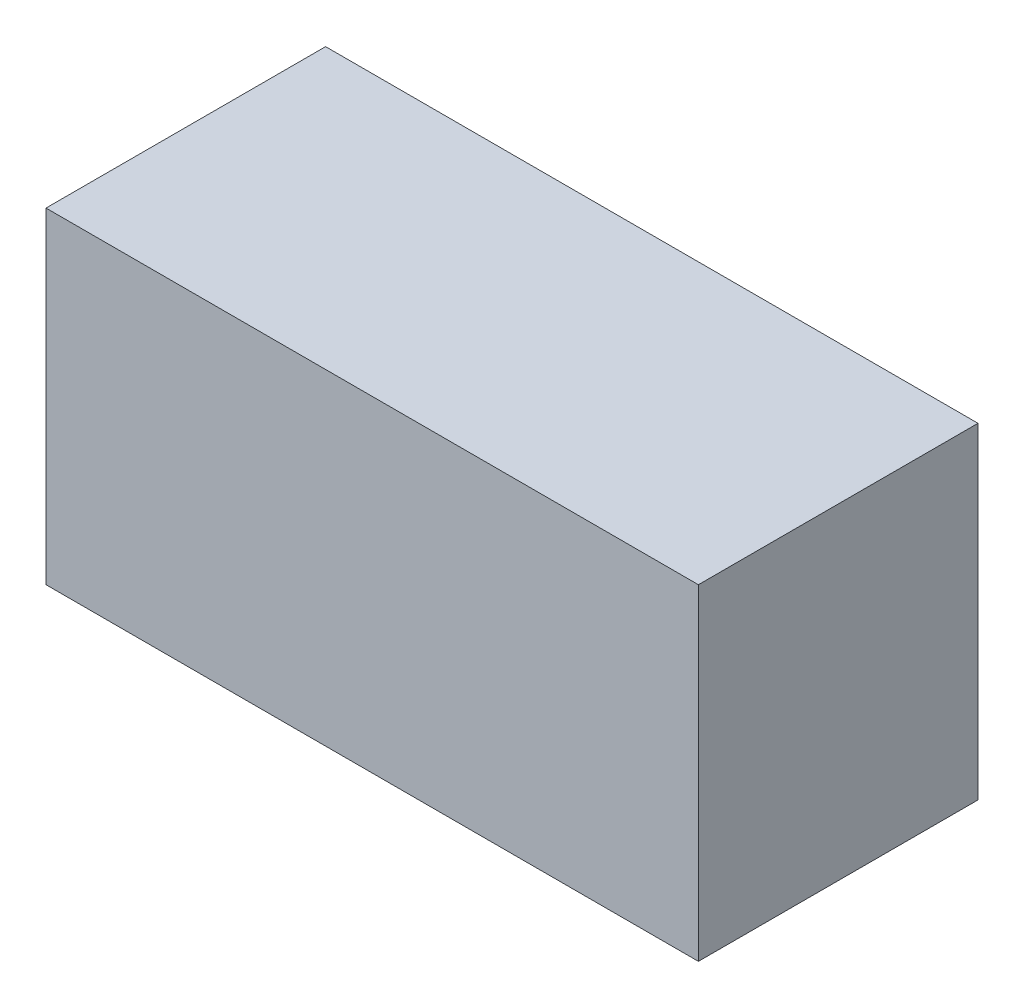
from build123d import *

# Parameters (mm, degrees)
IZIM1_W                     = 140
IZIM1_H                     = 70
Y_KSEKLIK_EKSTR_ZYON1_DEPTH = 60
IZIM10_W                    = 130
IZIM10_H                    = 50
KES_EKSTR_ZYON6_DEPTH       = 65
IZIM12_W                    = 35
IZIM12_H                    = 50
Y_KSEKLIK_EKSTR_ZYON3_DEPTH = 5


with BuildPart() as part:
    # Çizim1 → Yükseklik-Ekstrüzyon1 (new body)
    with BuildSketch(Plane.XY):
        with Locations((70, 35)):
            Rectangle(IZIM1_W, IZIM1_H)
    extrude(amount=Y_KSEKLIK_EKSTR_ZYON1_DEPTH)

    # Çizim10 → Kes-Ekstrüzyon6 (cut)
    with BuildSketch(Plane.XZ):
        with Locations((70, 30)):
            Rectangle(IZIM10_W, IZIM10_H)
    extrude(amount=-KES_EKSTR_ZYON6_DEPTH, mode=Mode.SUBTRACT)

    # Çizim12 → Yükseklik-Ekstrüzyon3 (add)
    with BuildSketch(Plane.XZ):
        with Locations((22.5, 30)):
            Rectangle(IZIM12_W, IZIM12_H)
        with Locations((117.5, 30)):
            Rectangle(IZIM12_W, IZIM12_H)
    extrude(amount=-Y_KSEKLIK_EKSTR_ZYON3_DEPTH)


solid = part.part
